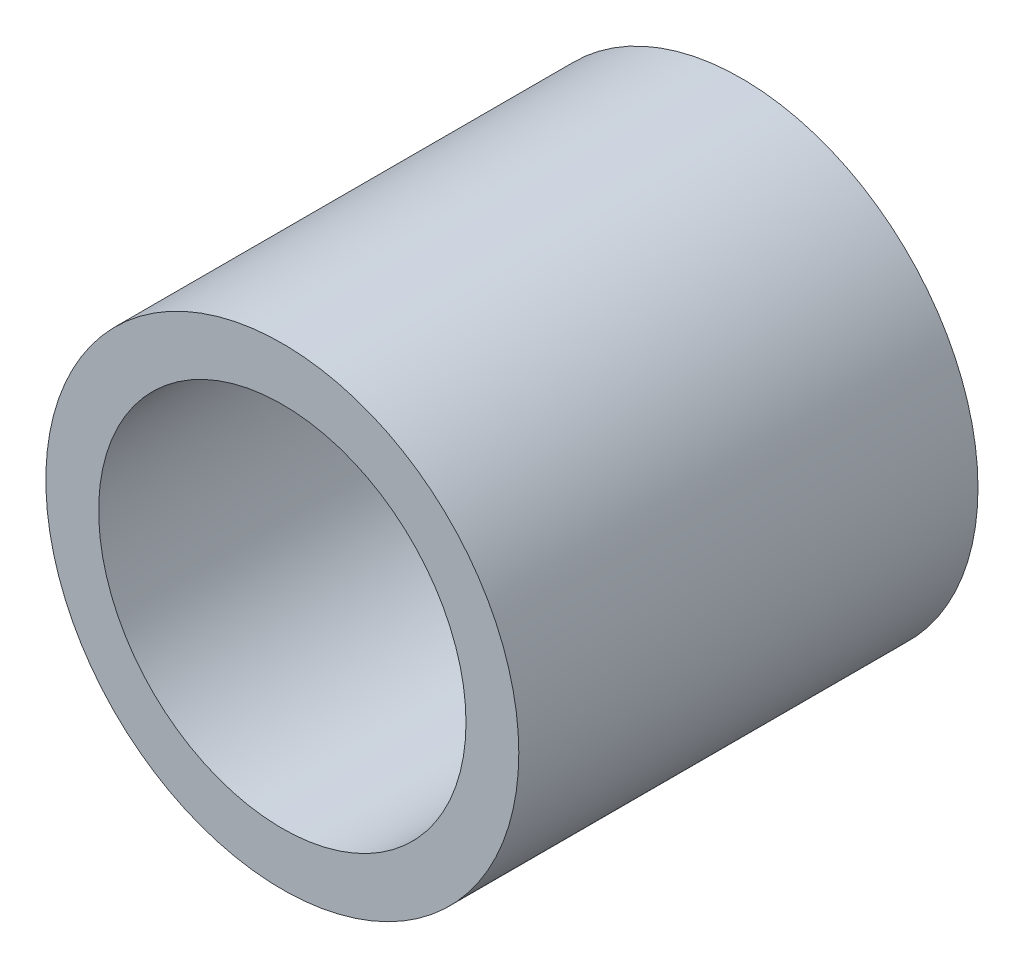
from build123d import *

# Parameters (mm, degrees)
SKETCH2_R           = 5.15
SKETCH2_R_2         = 4
BOSS_EXTRUDE1_DEPTH = 5


with BuildPart() as part:
    # Sketch2 → Boss-Extrude1 (new, symmetric)
    with BuildSketch(Plane.XY):
        Circle(SKETCH2_R)
        Circle(SKETCH2_R_2, mode=Mode.SUBTRACT)
    extrude(amount=BOSS_EXTRUDE1_DEPTH, both=True)


solid = part.part
